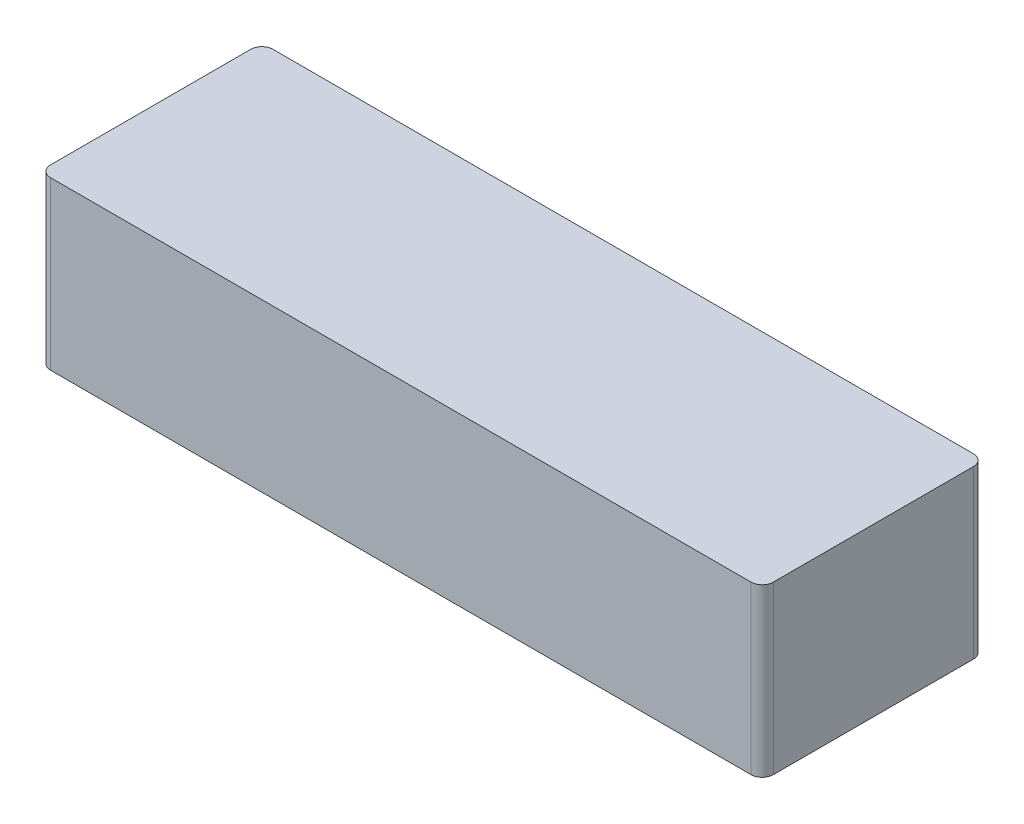
from build123d import *

# Parameters (mm, degrees)
SKETCH_1_W      = 130
SKETCH_1_H      = 30
EXTRUDE_1_DEPTH = 40
FILLET_1_R      = 2


with BuildPart() as part:
    # 草图1 → 凸台-拉伸1 (new body)
    with BuildSketch(Plane.XY):
        Rectangle(SKETCH_1_W, SKETCH_1_H)
    extrude(amount=EXTRUDE_1_DEPTH)

    # 圆角1
    fillet_1_edges = [part.edges().sort_by_distance(p)[0] for p in [
        (-65, 0, 40),
        (65, 0, 40),
        (-65, 0, 0),
        (65, 0, 0),
    ]]
    fillet(fillet_1_edges, radius=FILLET_1_R)


solid = part.part
